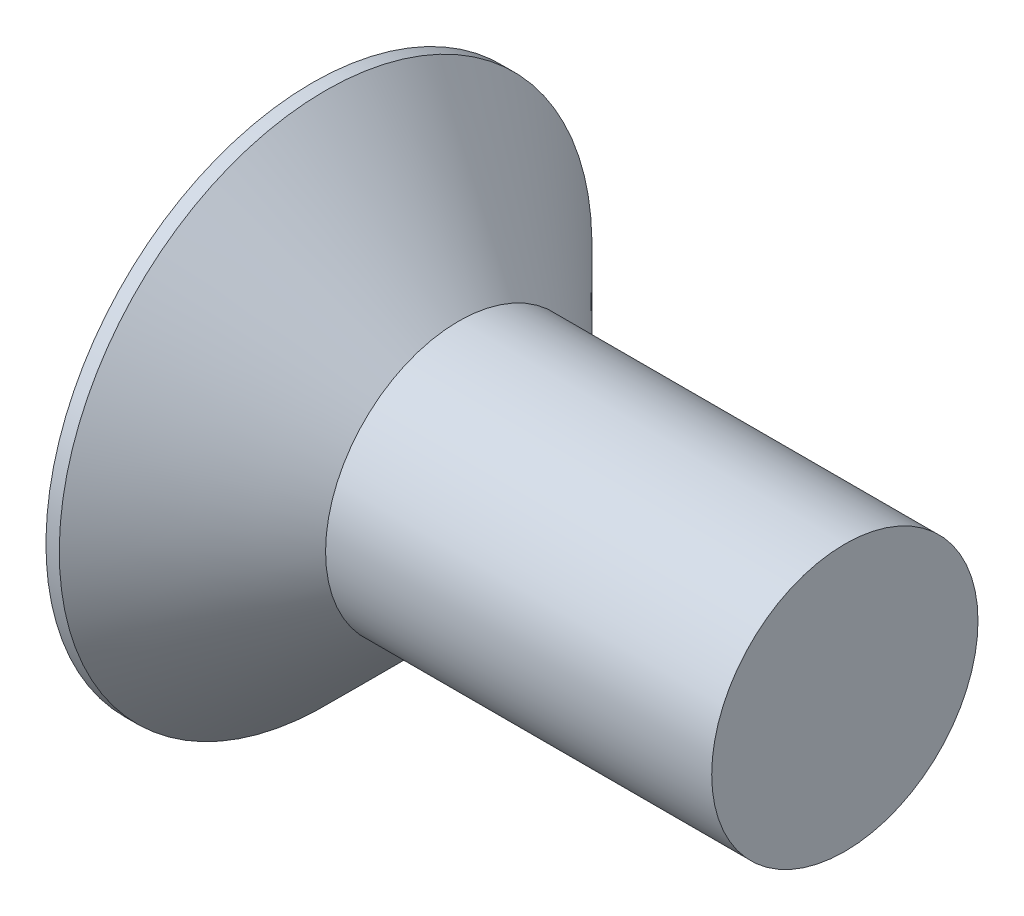
from build123d import *

# Parameters (mm, degrees)
CUT_EXTRUDE1_DEPTH = 4.4


with BuildPart() as part:
    # Sketch1 → Revolve1 (revolve)
    with BuildSketch(Plane.XY):
        Polygon((0, 0), (0, 10), (0.5, 10), (5.5, 5), (20, 5), (20, 0), align=None)
    revolve(axis=Axis((20, 0, 0), (-1, 0, 0)))

    # Sketch2 → Cut-Extrude1 (cut)
    with BuildSketch(Plane.ZY):
        Polygon((1.732050808, 3), (-1.732050808, 3), (-3.464101615, 0), (-1.732050808, -3), (1.732050808, -3), (3.464101615, 0), align=None)
    extrude(amount=-CUT_EXTRUDE1_DEPTH, mode=Mode.SUBTRACT)


solid = part.part
